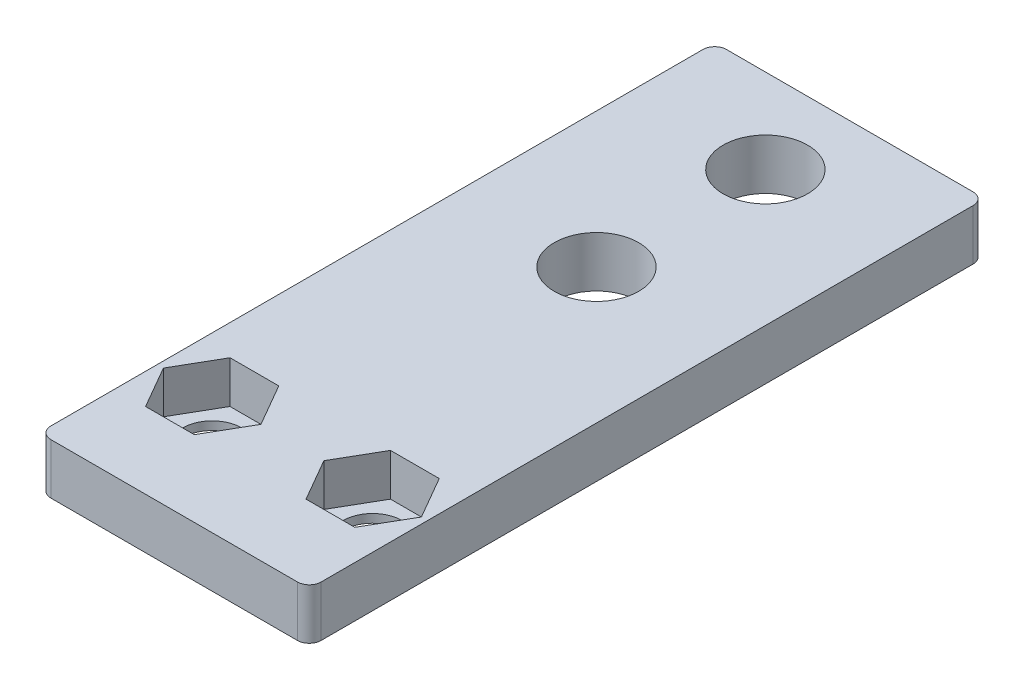
from build123d import *

# Parameters (mm, degrees)
SKETCH1_W           = 16
SKETCH1_H           = 40
SKETCH1_R           = 2.5
BOSS_EXTRUDE1_DEPTH = 3
SKETCH1_3_R         = 1.75
BOSS_EXTRUDE2_DEPTH = 0.5
FILLET1_R           = 0.7


with BuildPart() as part:
    # Sketch1 → Boss-Extrude1 (new body)
    with BuildSketch(Plane(origin=(0, 0, 0), x_dir=(1, 0, 0), z_dir=(0, 1, 0))):
        with Locations((8, 20)):
            Rectangle(SKETCH1_W, SKETCH1_H)
        Polygon((1.806624327, 9.5), (4.693375673, 9.5), (6.136751346, 7), (4.693375673, 4.5), (1.806624327, 4.5), (0.363248654, 7), align=None, mode=Mode.SUBTRACT)
        Polygon((9.863248654, 7), (11.306624327, 9.5), (14.193375673, 9.5), (15.636751346, 7), (14.193375673, 4.5), (11.306624327, 4.5), align=None, mode=Mode.SUBTRACT)
        with Locations((8, 25)):
            Circle(SKETCH1_R, mode=Mode.SUBTRACT)
        with Locations((8, 35)):
            Circle(SKETCH1_R, mode=Mode.SUBTRACT)
    extrude(amount=BOSS_EXTRUDE1_DEPTH)

    # Sketch1<3> → Boss-Extrude2 (add)
    # profile 1 of 2: a face of its own
    with BuildSketch(Plane(origin=(0, 0, 0), x_dir=(1, 0, 0), z_dir=(0, 1, 0))):
        Polygon((6.136751346, 7), (4.693375673, 9.5), (1.806624327, 9.5), (0.363248654, 7), (1.806624327, 4.5), (4.693375673, 4.5), align=None)
        with Locations((3.25, 7)):
            Circle(SKETCH1_3_R, mode=Mode.SUBTRACT)
    # profile 2 of 2: a face of its own
    with BuildSketch(Plane(origin=(0, 0, 0), x_dir=(1, 0, 0), z_dir=(0, 1, 0))):
        Polygon((14.193375673, 9.5), (11.306624327, 9.5), (9.863248654, 7), (11.306624327, 4.5), (14.193375673, 4.5), (15.636751346, 7), align=None)
        with Locations((12.75, 7)):
            Circle(SKETCH1_3_R, mode=Mode.SUBTRACT)
    extrude(amount=BOSS_EXTRUDE2_DEPTH)

    # Fillet1
    fillet1_edges = [part.edges().sort_by_distance(p)[0] for p in [
        (0, 1.5, 0),
        (16, 1.5, 0),
        (16, 1.5, -40),
        (0, 1.5, -40),
    ]]
    fillet(fillet1_edges, radius=FILLET1_R)


solid = part.part
